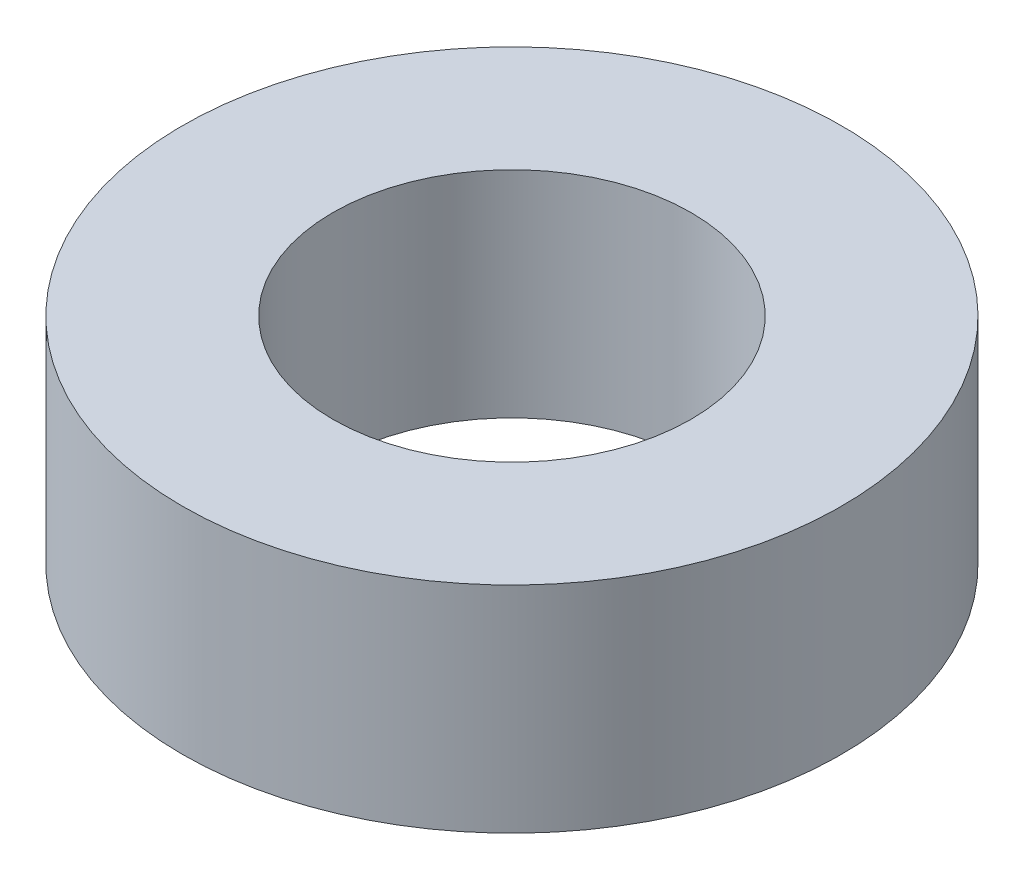
from build123d import *

# Parameters (mm, degrees)
SKETCH_1_R      = 230
SKETCH_1_R_2    = 125
EXTRUDE_1_DEPTH = 150


with BuildPart() as part:
    # 草图1 → 凸台-拉伸1 (new body)
    with BuildSketch(Plane(origin=(0, 0, 0), x_dir=(1, 0, 0), z_dir=(0, 1, 0))):
        with Locations(Location((0, 0, 0), (0, 0, 270))):
            Circle(SKETCH_1_R)
        with Locations(Location((0, 0, 0), (0, 0, 270))):
            Circle(SKETCH_1_R_2, mode=Mode.SUBTRACT)
    extrude(amount=EXTRUDE_1_DEPTH)


solid = part.part
